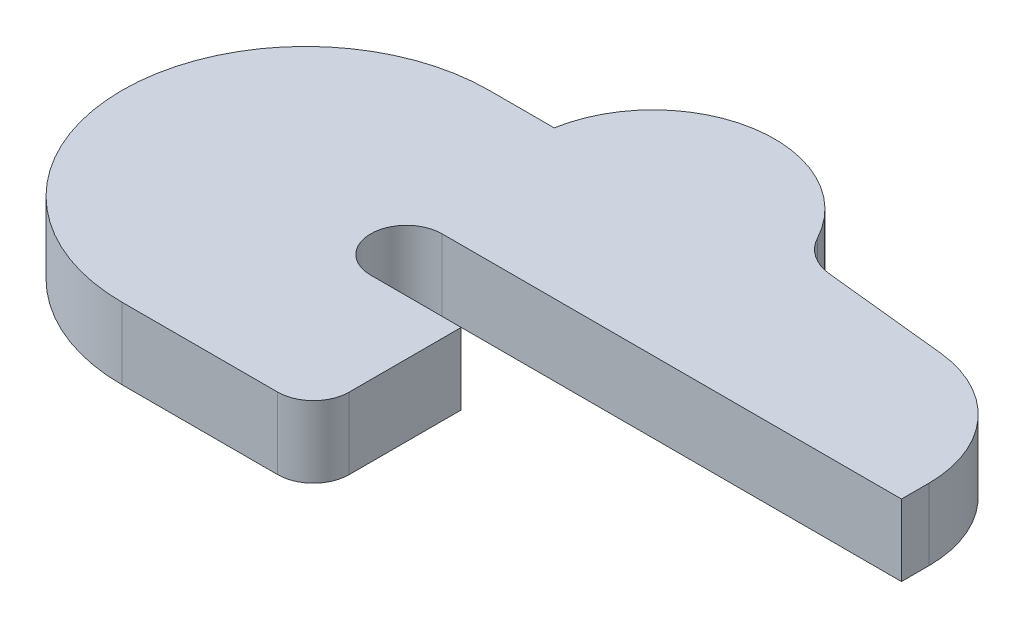
from build123d import *

# Parameters (mm, degrees)
BOSS_EXTRUDE2_DEPTH = 3


with BuildPart() as part:
    # Sketch1 → Boss-Extrude2 (new body)
    with BuildSketch(Plane(origin=(0, 0, 0), x_dir=(1, 0, 0), z_dir=(0, 1, 0))):
        with BuildLine():
            Line((0, 0), (-3.8, 0))
            ThreePointArc((-3.8, 0), (-5.3, 1.5), (-3.8, 3))
            Line((-3.8, 3), (15.47, 3))
            Line((15.47, 3), (15.47, 4.149016738))
            ThreePointArc((15.47, 4.149016738), (14.185724127, 7.49466977), (10.992642316, 9.121626215))
            Line((10.992642316, 9.121626215), (5.783295319, 9.669150648))
            ThreePointArc((5.783295319, 9.669150648), (4.874143319, 10), (4.226657422, 10.718874584))
            ThreePointArc((4.226657422, 10.718874584), (-1.078837134, 13.36), (-5.3, 9.2))
            Line((-5.3, 9.2), (-8.03, 9.2))
            ThreePointArc((-8.03, 9.2), (-15.73, 1.5), (-8.03, -6.2))
            Line((-8.03, -6.2), (-1.5, -6.2))
            ThreePointArc((-1.5, -6.2), (-0.439339828, -5.760660172), (0, -4.7))
            Line((0, -4.7), (0, 0))
        make_face()
    extrude(amount=BOSS_EXTRUDE2_DEPTH)


solid = part.part
